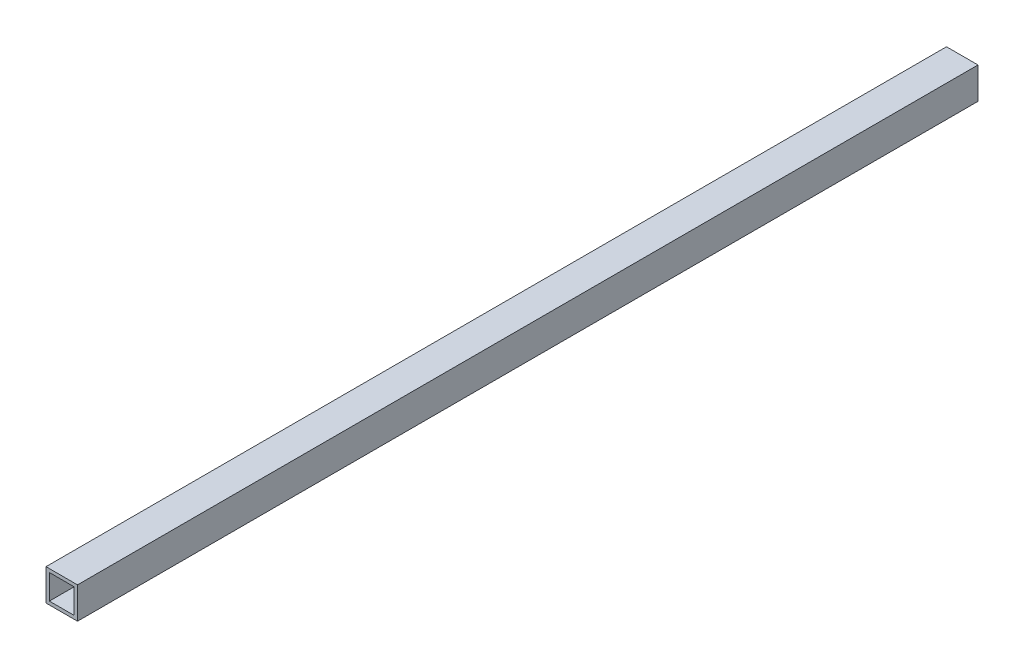
from build123d import *

# Parameters (mm, degrees)
SKETCH_1_W      = 14
SKETCH_1_H      = 14
SKETCH_1_W_2    = 11
SKETCH_1_H_2    = 11
EXTRUDE_1_DEPTH = 400


with BuildPart() as part:
    # 草图1 → 拉伸-薄壁1 (new body)
    with BuildSketch(Plane.XY):
        Rectangle(SKETCH_1_W, SKETCH_1_H)
        Rectangle(SKETCH_1_W_2, SKETCH_1_H_2, mode=Mode.SUBTRACT)
    extrude(amount=EXTRUDE_1_DEPTH)


solid = part.part
